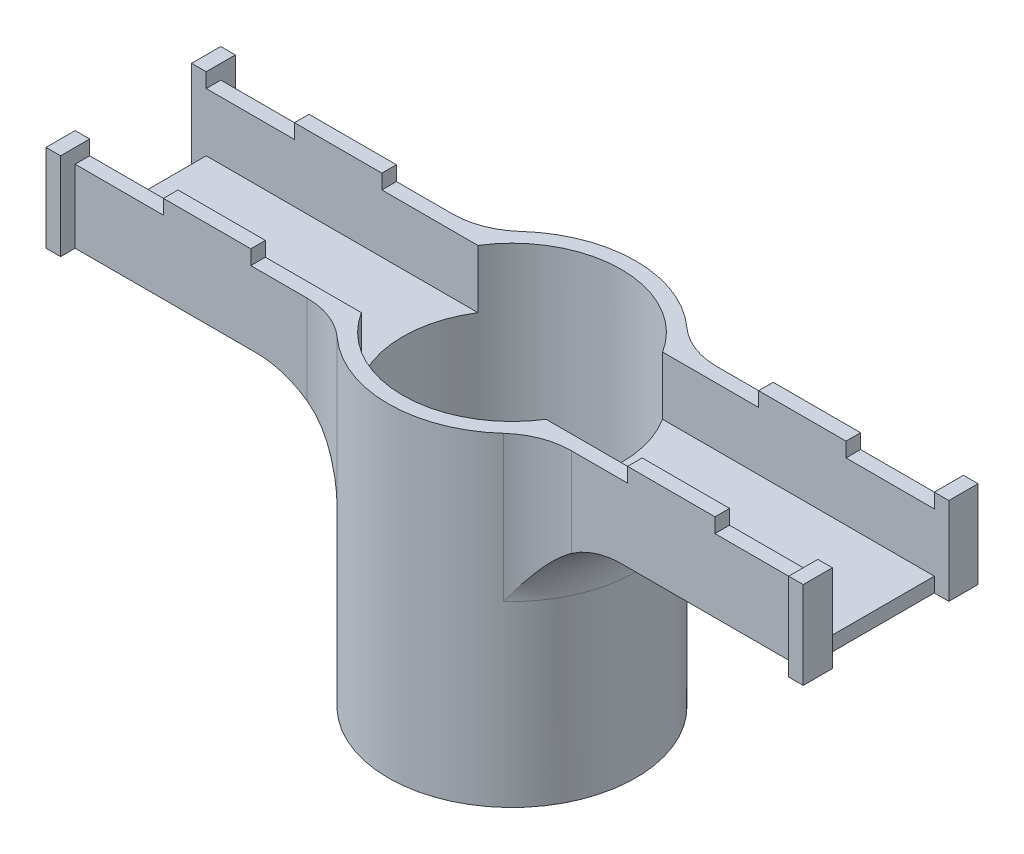
from build123d import *

# Parameters (mm, degrees)
SKETCH_1_R               = 17
SKETCH_1_R_2             = 7
SKETCH_1_R_3             = 1.6
EXTRUDE_1_DEPTH          = 2
EXTRUDE_START            = 42.5
SKETCH_2_R               = 17
SKETCH_2_R_2             = 15
EXTRUDE_2_DEPTH          = 42.5
EXTRUDE_3_REACH          = 83.143
EXTRUDE_3_END_RADIUS     = 17
SKETCH_5_W               = 4
SKETCH_5_H               = 12
EXTRUDE_4_DEPTH          = 2
CUT_EXTRUDE_1_REACH      = 84.209
SKETCH_6_W               = 16
SKETCH_6_H               = 8
SKETCH_7_W               = 12
SKETCH_7_H               = 2
EXTRUDE_5_DEPTH          = 2
MIRROR_2_COPY_1_SKETCH_W = 12
MIRROR_2_COPY_1_SKETCH_H = 2
MIRROR_2_COPY_1_DEPTH    = 2
MIRROR_2_COPY_2_SKETCH_W = 12
MIRROR_2_COPY_2_SKETCH_H = 2
MIRROR_2_COPY_2_DEPTH    = 2
FILLET_1_R               = 10


with BuildPart() as part:
    # 草图1 → 凸台-拉伸1 (new body)
    with BuildSketch(Plane(origin=(0, 0, 0), x_dir=(1, 0, 0), z_dir=(0, 1, 0))):
        with Locations(Location((0, 0, 0), (0, 0, 270))):
            Circle(SKETCH_1_R)
        with Locations(Location((0, 0, 0), (0, 0, 270))):
            Circle(SKETCH_1_R_2, mode=Mode.SUBTRACT)
        with Locations(Location((6.717514421, 6.717514421, 0), (0, 0, 270))):
            Circle(SKETCH_1_R_3, mode=Mode.SUBTRACT)
        with Locations(Location((2.458780928, -9.17629535, 0), (0, 0, 270))):
            Circle(SKETCH_1_R_3, mode=Mode.SUBTRACT)
        with Locations(Location((-9.17629535, 2.458780928, 0), (0, 0, 270))):
            Circle(SKETCH_1_R_3, mode=Mode.SUBTRACT)
    extrude(amount=-EXTRUDE_1_DEPTH)

    # 草图2 → 凸台-拉伸2 (add)
    with BuildSketch(Plane(origin=(0, 0, 0), x_dir=(1, 0, 0), z_dir=(0, 1, 0)).offset(EXTRUDE_START)):
        with Locations(Location((0, 0, 0), (0, 0, 270))):
            Circle(SKETCH_2_R)
        with Locations(Location((0, 0, 0), (0, 0, 270))):
            Circle(SKETCH_2_R_2, mode=Mode.SUBTRACT)
    extrude(amount=-EXTRUDE_2_DEPTH)

    # 凸台-拉伸3: up to this cylinder (the profile starts outside it)
    extrude_3_end = Plane(origin=(0, 42.276393, 0), z_dir=(0, 1, 0)) * Cylinder(EXTRUDE_3_END_RADIUS, 201.286, mode=Mode.PRIVATE)
    # 草图4 → 凸台-拉伸3 (add, up to the surface)
    with BuildSketch(Plane(origin=(50, 0, 0), x_dir=(0, 0, -1), z_dir=(1, 0, 0)), mode=Mode.PRIVATE) as extrude_3_sk1:
        Polygon((-10, 42.5), (-8, 42.5), (-8, 34.5), (8, 34.5), (8, 42.5), (10, 42.5), (10, 32.5), (-10, 32.5), align=None)
    extrude_3_tool1 = extrude(extrude_3_sk1.sketch, amount=-EXTRUDE_3_REACH, mode=Mode.PRIVATE) - extrude_3_end
    extrude_3 = extrude_3_tool1.solids().sort_by_distance((50, 42.276393, 9))[0]
    add(extrude_3)

    # 草图5 → 凸台-拉伸4 (add)
    with BuildSketch(Plane(origin=(50, 0, 0), x_dir=(0, 0, -1), z_dir=(1, 0, 0))):
        with Locations((-10, 38.5)):
            Rectangle(SKETCH_5_W, SKETCH_5_H)
        with Locations((10, 38.5)):
            Rectangle(SKETCH_5_W, SKETCH_5_H)
    extrude_4 = extrude(amount=EXTRUDE_4_DEPTH)

    # 草图6 → 切除-拉伸1 (cut, up to next)
    with BuildSketch(Plane(origin=(50, 0, 0), x_dir=(0, 0, -1), z_dir=(1, 0, 0)), mode=Mode.PRIVATE) as cut_extrude_1_sk1:
        with Locations((0, 38.5)):
            Rectangle(SKETCH_6_W, SKETCH_6_H)
    cut_extrude_1_tool1 = extrude(cut_extrude_1_sk1.sketch, amount=-CUT_EXTRUDE_1_REACH, mode=Mode.PRIVATE) & part.part
    cut_extrude_1 = cut_extrude_1_tool1.solids().sort_by_distance((50, 38.5, 0))[0]
    add(cut_extrude_1, mode=Mode.SUBTRACT)

    # 草图7 → 凸台-拉伸5 (add)
    with BuildSketch(Plane(origin=(0, 42.5, 0), x_dir=(1, 0, 0), z_dir=(0, 1, 0))):
        with Locations((31.873863542, -9)):
            Rectangle(SKETCH_7_W, SKETCH_7_H)
    extrude_5 = extrude(amount=EXTRUDE_5_DEPTH)

    # 镜向1: 凸台-拉伸5 across plane
    add(extrude_5.mirror(Plane.XY))

    # 镜向2: 凸台-拉伸3, 凸台-拉伸4, 切除-拉伸1 across plane
    add(extrude_3.mirror(Plane(origin=(0, 0, 0), x_dir=(0, 0, 1), z_dir=(1, 0, 0))))
    add(extrude_4.mirror(Plane(origin=(0, 0, 0), x_dir=(0, 0, 1), z_dir=(1, 0, 0))))
    add(cut_extrude_1.mirror(Plane(origin=(0, 0, 0), x_dir=(0, 0, 1), z_dir=(1, 0, 0))), mode=Mode.SUBTRACT)

    # 镜向2 copy 1 sketch → 镜向2 copy 1 (add)
    with BuildSketch(Plane(origin=(0, 42.5, 0), x_dir=(-1, 0, 0), z_dir=(0, 1, 0))):
        with Locations((31.873863542, -9)):
            Rectangle(MIRROR_2_COPY_1_SKETCH_W, MIRROR_2_COPY_1_SKETCH_H)
    extrude(amount=MIRROR_2_COPY_1_DEPTH)

    # 镜向2 copy 2 sketch → 镜向2 copy 2 (add)
    with BuildSketch(Plane(origin=(0, 42.5, 0), x_dir=(-1, 0, 0), z_dir=(0, 1, 0))):
        with Locations((31.873863542, 9)):
            Rectangle(MIRROR_2_COPY_2_SKETCH_W, MIRROR_2_COPY_2_SKETCH_H)
    extrude(amount=MIRROR_2_COPY_2_DEPTH)

    # 圆角1
    fillet_1_edges = [part.edges().sort_by_distance(p)[0] for p in [
        (-13.747727085, 37.5, 10),
        (-13.747727085, 37.5, -10),
        (-17, 32.5, 0),
        (13.747727085, 37.5, 10),
        (13.747727085, 37.5, -10),
        (17, 32.5, 0),
    ]]
    fillet(fillet_1_edges, radius=FILLET_1_R)


solid = part.part
